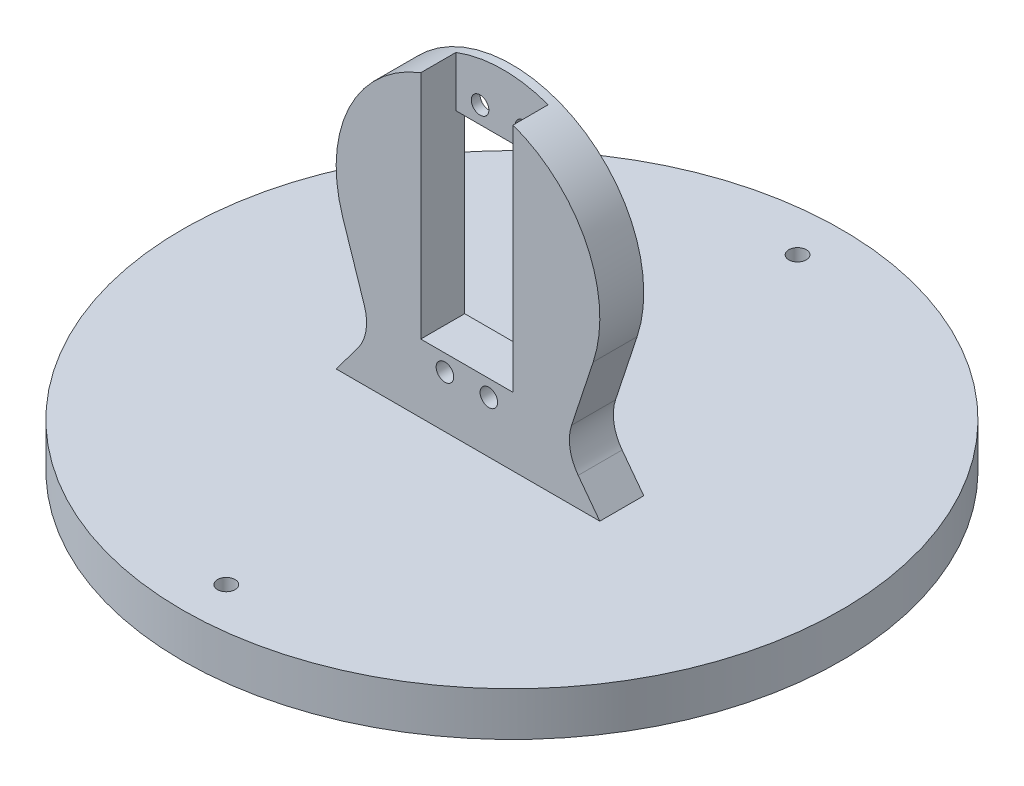
from build123d import *
from build123d.topology import SkipClean

# Parameters (mm, degrees)
ESQUISSE1_R        = 75
ESQUISSE1_R_2      = 2
BOSS_EXTRU_1_DEPTH = 10
ESQUISSE2_R        = 2
ESQUISSE2_W        = 21
ESQUISSE2_H        = 41
ESQUISSE2_H_2      = 6.85
BOSS_EXTRU_2_DEPTH = 2
BOSS_EXTRU_5_START = 2
ESQUISSE2_7_R      = 2
BOSS_EXTRU_5_DEPTH = 8


with BuildPart() as part:
    # Esquisse1 → Boss.-Extru.1 (new body)
    with BuildSketch(Plane(origin=(0, 0, 0), x_dir=(1, 0, 0), z_dir=(0, 1, 0))):
        with Locations(Location((0, 0, 0), (0, 0, 270))):
            Circle(ESQUISSE1_R)
        with Locations(Location((0, 65, 0), (0, 0, 270))):
            Circle(ESQUISSE1_R_2, mode=Mode.SUBTRACT)
        with Locations(Location((0, -65, 0), (0, 0, 270))):
            Circle(ESQUISSE1_R_2, mode=Mode.SUBTRACT)
    extrude(amount=BOSS_EXTRU_1_DEPTH)

    # Esquisse2 → Boss.-Extru.2 (add)
    # profile 1 of 3: a face of its own
    with BuildSketch(Plane.XY):
        with BuildLine():
            ThreePointArc((-25.073934757, 16.568086991), (-23.205708304, 20.950030541), (-23.576750129, 25.699138596))
            Line((-23.576750129, 25.699138596), (-28.491553882, 40.606845184))
            ThreePointArc((-28.491553882, 40.606845184), (0, 80), (28.491553882, 40.606845184))
            Line((28.491553882, 40.606845184), (23.576750129, 25.699138596))
            ThreePointArc((23.576750129, 25.699138596), (23.205708304, 20.950030541), (25.073934757, 16.568086991))
            Line((25.073934757, 16.568086991), (30, 10))
            Line((30, 10), (-30, 10))
            Line((-30, 10), (-25.073934757, 16.568086991))
        make_face()
        with Locations((4.751288604, 21.76470447)):
            Circle(ESQUISSE2_R, mode=Mode.SUBTRACT)
        with Locations((-5.248711396, 21.76470447)):
            Circle(ESQUISSE2_R, mode=Mode.SUBTRACT)
        with Locations((-5.248711396, 70.39470447)):
            Circle(ESQUISSE2_R, mode=Mode.SUBTRACT)
        with Locations((4.751288604, 70.39470447)):
            Circle(ESQUISSE2_R, mode=Mode.SUBTRACT)
        with Locations((-0.248711396, 46.01543183)):
            Rectangle(ESQUISSE2_W, ESQUISSE2_H, mode=Mode.SUBTRACT)
    # profile 2 of 3: a face of its own
    with BuildSketch(Plane.XY):
        with Locations((-0.248711396, 69.94043183)):
            Rectangle(ESQUISSE2_W, ESQUISSE2_H_2)
        with Locations((-5.248711396, 70.39470447)):
            Circle(ESQUISSE2_R, mode=Mode.SUBTRACT)
        with Locations((4.751288604, 70.39470447)):
            Circle(ESQUISSE2_R, mode=Mode.SUBTRACT)
    # profile 3 of 3: a face of its own
    with BuildSketch(Plane.XY):
        with BuildLine():
            Line((10.251288604, 73.36543183), (10.251288604, 78.194167517))
            ThreePointArc((10.251288604, 78.194167517), (-0.265506097, 79.998825086), (-10.748711396, 78.00830597))
            Line((-10.748711396, 78.00830597), (-10.748711396, 73.36543183))
            Line((-10.748711396, 73.36543183), (10.251288604, 73.36543183))
        make_face()
    extrude(amount=BOSS_EXTRU_2_DEPTH)

    # Esquisse2<7> → Boss.-Extru.5 (add)
    with SkipClean():  # the faces are left unmerged after this step: merging them gives an invalid solid
        with BuildSketch(Plane.XY.offset(BOSS_EXTRU_5_START)):
            with BuildLine():
                Line((23.576750129, 25.699138596), (28.491553882, 40.606845184))
                ThreePointArc((28.491553882, 40.606845184), (26.989880715, 63.097569965), (10.251288604, 78.194167517))
                Line((10.251288604, 78.194167517), (10.251288604, 73.36543183))
                Line((10.251288604, 73.36543183), (10.251288604, 66.51543183))
                Line((10.251288604, 66.51543183), (10.251288604, 25.51543183))
                Line((10.251288604, 25.51543183), (-10.748711396, 25.51543183))
                Line((-10.748711396, 25.51543183), (-10.748711396, 66.51543183))
                Line((-10.748711396, 66.51543183), (-10.748711396, 73.36543183))
                Line((-10.748711396, 73.36543183), (-10.748711396, 78.00830597))
                ThreePointArc((-10.748711396, 78.00830597), (-27.104739844, 62.858191085), (-28.491553882, 40.606845184))
                Line((-28.491553882, 40.606845184), (-23.576750129, 25.699138596))
                ThreePointArc((-23.576750129, 25.699138596), (-23.205708304, 20.950030541), (-25.073934757, 16.568086991))
                Line((-25.073934757, 16.568086991), (-30, 10))
                Line((-30, 10), (30, 10))
                Line((30, 10), (25.073934757, 16.568086991))
                ThreePointArc((25.073934757, 16.568086991), (23.205708304, 20.950030541), (23.576750129, 25.699138596))
            make_face()
            with Locations((-5.248711396, 21.76470447)):
                Circle(ESQUISSE2_7_R, mode=Mode.SUBTRACT)
            with Locations((4.751288604, 21.76470447)):
                Circle(ESQUISSE2_7_R, mode=Mode.SUBTRACT)
        extrude(amount=BOSS_EXTRU_5_DEPTH)


solid = part.part
